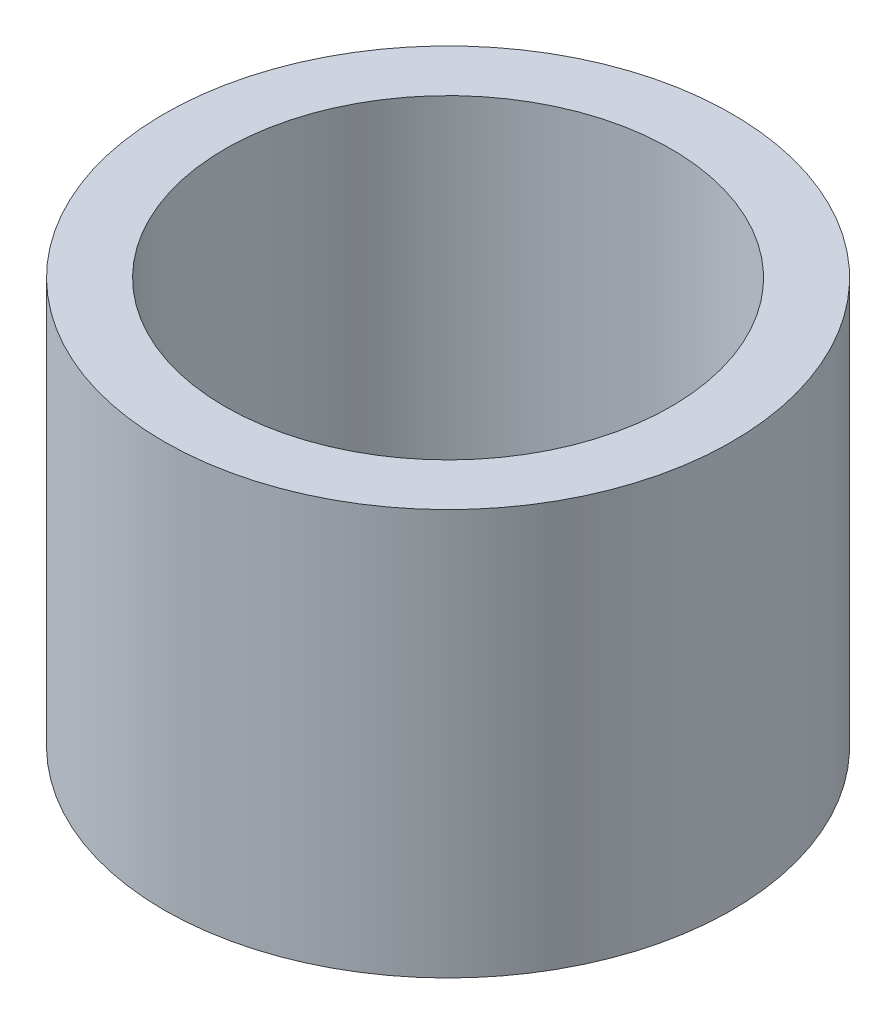
from build123d import *

# Parameters (mm, degrees)
SKETCH1_R           = 7
SKETCH1_R_2         = 5.5
BOSS_EXTRUDE1_DEPTH = 10


with BuildPart() as part:
    # Sketch1 → Boss-Extrude1 (new body)
    with BuildSketch(Plane(origin=(0, 0, 0), x_dir=(1, 0, 0), z_dir=(0, 1, 0))):
        with Locations(Location((0, 0, 0), (0, 0, 270))):
            Circle(SKETCH1_R)
        with Locations(Location((0, 0, 0), (0, 0, 270))):
            Circle(SKETCH1_R_2, mode=Mode.SUBTRACT)
    extrude(amount=BOSS_EXTRUDE1_DEPTH)


solid = part.part
